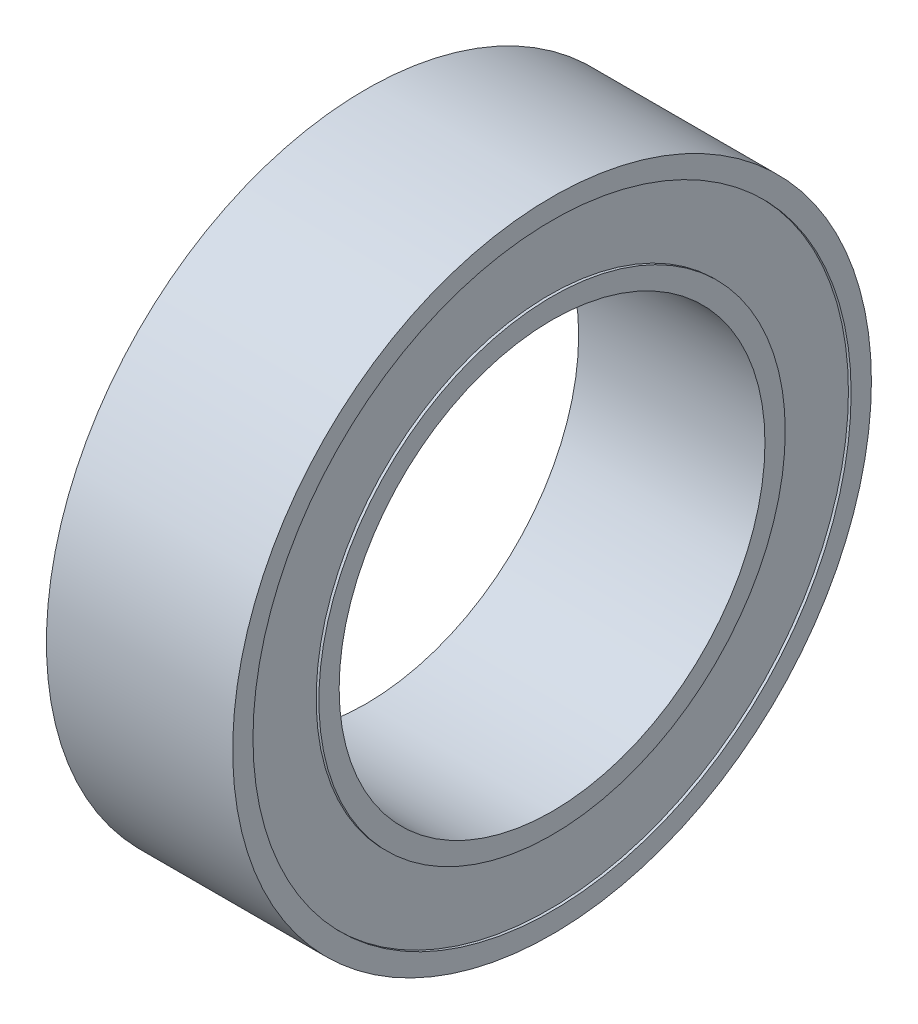
from build123d import *

# Parameters (mm, degrees)
SKETCH1_R           = 6
SKETCH1_R_2         = 4
BOSS_EXTRUDE1_DEPTH = 1.75
SKETCH2_R           = 5.619
SKETCH2_R_2         = 4.381
CUT_EXTRUDE1_DEPTH  = 0.0508


with BuildPart() as part:
    # Sketch1 → Boss-Extrude1 (new, symmetric)
    with BuildSketch(Plane(origin=(0, 0, 0), x_dir=(0, 0, -1), z_dir=(1, 0, 0))):
        Circle(SKETCH1_R)
        Circle(SKETCH1_R_2, mode=Mode.SUBTRACT)
    extrude(amount=BOSS_EXTRUDE1_DEPTH, both=True)

    # Sketch2 → Cut-Extrude1 (cut)
    with BuildSketch(Plane(origin=(1.75, 0, 0), x_dir=(0, 0, -1), z_dir=(1, 0, 0))):
        Circle(SKETCH2_R)
        Circle(SKETCH2_R_2, mode=Mode.SUBTRACT)
    cut_extrude1 = extrude(amount=-CUT_EXTRUDE1_DEPTH, mode=Mode.SUBTRACT)

    # Mirror1: Cut-Extrude1 across plane
    add(cut_extrude1.mirror(Plane(origin=(0, 0, 0), x_dir=(0, 0, 1), z_dir=(1, 0, 0))), mode=Mode.SUBTRACT)


solid = part.part
